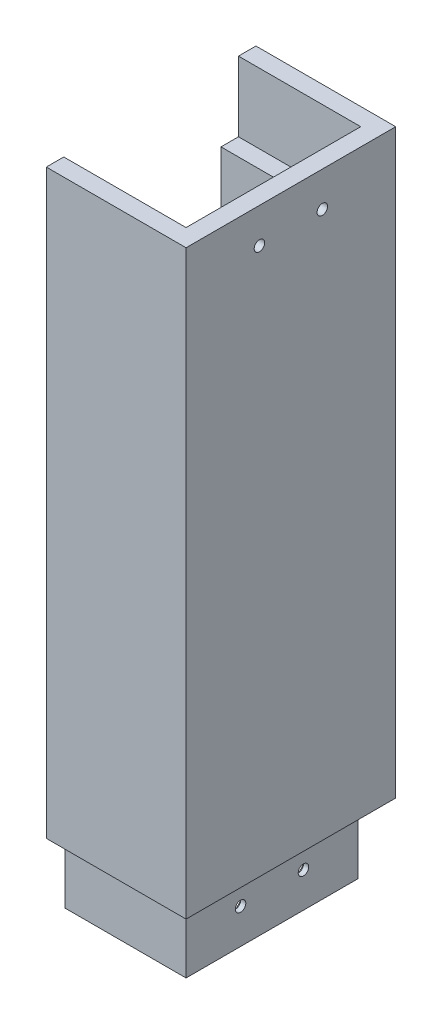
from build123d import *

# Parameters (mm, degrees)
BOSS_EXTRUDE1_START                       = 12.7
BOSS_EXTRUDE1_DEPTH                       = 12.7
BOSS_EXTRUDE2_DEPTH                       = 12.7
SKETCH7_R                                 = 0.9525
CUT_EXTRUDE1_DEPTH                        = 111.090903984
SKETCH10_R                                = 0.9525
CUT_EXTRUDE2_DEPTH                        = 110.494104933
CSK_FOR_6_FLAT_HEAD_MACHINE_SCREW_2_COUNT = 2
CSK_FOR_6_FLAT_HEAD_MACHINE_SCREW_2_PITCH = 11.43


with BuildPart() as part:
    # Sweep1: sweep along a path in Sketch4
    with BuildLine(Plane.XY) as sweep1_path:
        Line((0, 0), (0, -92.964))
    # Sketch3 → Sweep1 (sweep)
    with BuildSketch(Plane(origin=(0, 0, 0), x_dir=(1, 0, 0), z_dir=(0, 1, 0))):
        with BuildLine():
            Line((0, 16.62500014), (-25.4, 16.62500014))
            Line((-25.4, 16.62500014), (-25.4, 10.27500014))
            Line((-25.4, 10.27500014), (-6.985, 10.27500014))
            ThreePointArc((-6.985, 10.27500014), (-6.535987194, 10.089012946), (-6.35, 9.64000014))
            Line((-6.35, 9.64000014), (-6.35, -14.48999986))
            ThreePointArc((-6.35, -14.48999986), (-6.535987194, -14.939012666), (-6.985, -15.12499986))
            Line((-6.985, -15.12499986), (-25.4, -15.12499986))
            Line((-25.4, -15.12499986), (-25.4, -21.47499986))
            Line((-25.4, -21.47499986), (0, -21.47499986))
            Line((0, -21.47499986), (0, 16.62500014))
        make_face()
    sweep(path=sweep1_path.line)

    # Sketch5 → Boss-Extrude1 (add)
    with BuildSketch(Plane.XZ.offset(92.964).offset(BOSS_EXTRUDE1_START)):
        with BuildLine():
            Line((-25.4, 18.04599986), (-3.429, 18.04599986))
            Line((-3.429, 18.04599986), (-3.429, -13.19600014))
            Line((-3.429, -13.19600014), (-25.4, -13.19600014))
            Line((-25.4, -13.19600014), (-25.4, -10.27500014))
            Line((-25.4, -10.27500014), (-6.985, -10.27500014))
            ThreePointArc((-6.985, -10.27500014), (-6.535987194, -10.089012946), (-6.35, -9.64000014))
            Line((-6.35, -9.64000014), (-6.35, 14.48999986))
            ThreePointArc((-6.35, 14.48999986), (-6.535987194, 14.939012666), (-6.985, 15.12499986))
            Line((-6.985, 15.12499986), (-25.4, 15.12499986))
            Line((-25.4, 15.12499986), (-25.4, 18.04599986))
        make_face()
    extrude(amount=-BOSS_EXTRUDE1_DEPTH)

    # Sketch6 → Boss-Extrude2 (add)
    with BuildSketch(Plane(origin=(0, 0, 0), x_dir=(1, 0, 0), z_dir=(0, 1, 0))):
        Polygon((-25.4, 13.45000014), (-25.4, 16.62500014), (0, 16.62500014), (0, -21.47499986), (-25.4, -21.47499986), (-25.4, -18.29999986), (-3.175, -18.29999986), (-3.175, 13.45000014), align=None)
    extrude(amount=BOSS_EXTRUDE2_DEPTH)

    # Sketch7 → Cut-Extrude1 (cut, through all)
    with BuildSketch(Plane.ZY.offset(3.175)):
        with Locations((-3.29000014, 6.35)):
            Circle(SKETCH7_R)
        with Locations((8.13999986, 6.35)):
            Circle(SKETCH7_R)
    extrude(amount=-CUT_EXTRUDE1_DEPTH, mode=Mode.SUBTRACT)

    # Sketch10 → Cut-Extrude2 (cut, through all)
    with BuildSketch(Plane.ZY.offset(6.35)):
        with Locations((-3.29000014, -99.314)):
            Circle(SKETCH10_R)
        with Locations((8.13999986, -99.314)):
            Circle(SKETCH10_R)
    extrude(amount=-CUT_EXTRUDE2_DEPTH, mode=Mode.SUBTRACT)

    # Sketch13 → CSK for #6 Flat Head Machine Screw (100)2 (revolve, cut)
    with BuildSketch(Plane(origin=(-6.35, -99.314, -3.29000014), x_dir=(0, 0, 1), z_dir=(0, 1, 0))):
        Polygon((0, 0), (0, 2.563442612), (2.15265, 1.27), (2.15265, 1.166893902), (3.5433, 0), align=None)
    csk_for_6_flat_head_machine_screw_100 = revolve(axis=Axis((-12.7, -99.314, -3.29000014), (1, 0, 0)), mode=Mode.SUBTRACT)

    # CSK for _6 Flat Head Machine Screw _ 2: CSK for #6 Flat Head Machine Screw (100)2 ×2
    with Locations(*[(0, 0, i * CSK_FOR_6_FLAT_HEAD_MACHINE_SCREW_2_PITCH) for i in range(1, CSK_FOR_6_FLAT_HEAD_MACHINE_SCREW_2_COUNT)]):
        add(csk_for_6_flat_head_machine_screw_100, mode=Mode.SUBTRACT)


solid = part.part
